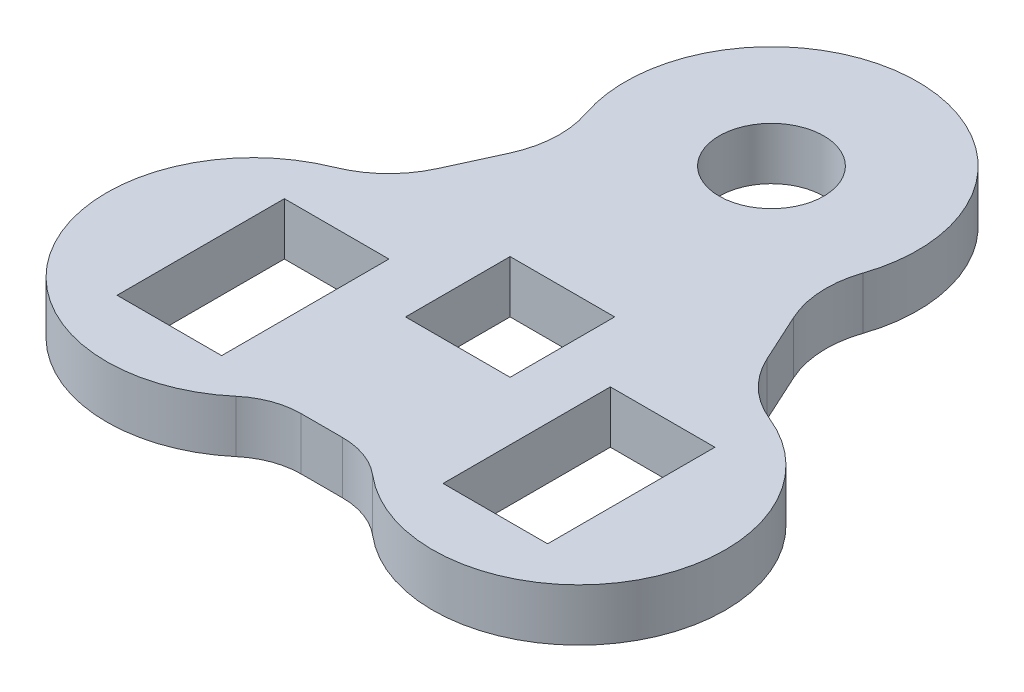
from build123d import *

# Parameters (mm, degrees)
SKETCH1_R           = 50
SKETCH1_W           = 100
SKETCH1_H           = 100
SKETCH1_H_2         = 160
BOSS_EXTRUDE1_DEPTH = 50


with BuildPart() as part:
    # Sketch1 → Boss-Extrude1 (new body)
    with BuildSketch(Plane(origin=(0, 0, 0), x_dir=(1, 0, 0), z_dir=(0, 1, 0))):
        with BuildLine():
            Line((-157.631299989, 88.07121729), (-136.663415109, 133.755017511))
            Line((-136.663415109, 133.755017511), (-135.958224263, 135.291452776))
            ThreePointArc((-135.958224263, 135.291452776), (-127.47369707, 169.829345008), (-132.36344953, 205.056373302))
            ThreePointArc((-132.36344953, 205.056373302), (0, 389.785594222), (132.36344953, 205.056373302))
            ThreePointArc((132.36344953, 205.056373302), (127.47369707, 169.829345008), (135.958224263, 135.291452776))
            Line((135.958224263, 135.291452776), (136.663415109, 133.755017511))
            Line((136.663415109, 133.755017511), (157.631299989, 88.07121729))
            ThreePointArc((157.631299989, 88.07121729), (178.287067415, 59.119663384), (208.18524924, 39.859551103))
            ThreePointArc((208.18524924, 39.859551103), (275.706725604, -162.3983111), (65.252859665, -196.699373836))
            ThreePointArc((65.252859665, -196.699373836), (44.010636723, -184.306940013), (19.797939242, -180))
            Line((19.797939242, -180), (-19.797939242, -180))
            ThreePointArc((-19.797939242, -180), (-44.010636723, -184.306940013), (-65.252859665, -196.699373836))
            ThreePointArc((-65.252859665, -196.699373836), (-275.706725604, -162.3983111), (-208.18524924, 39.859551103))
            ThreePointArc((-208.18524924, 39.859551103), (-178.287067415, 59.119663384), (-157.631299989, 88.07121729))
        make_face()
        with Locations(Location((0, 250, 0), (0, 0, 270))):
            Circle(SKETCH1_R, mode=Mode.SUBTRACT)
        Rectangle(SKETCH1_W, SKETCH1_H, mode=Mode.SUBTRACT)
        with Locations((155.884572681, -90)):
            Rectangle(SKETCH1_W, SKETCH1_H_2, mode=Mode.SUBTRACT)
        with Locations((-155.884572681, -90)):
            Rectangle(SKETCH1_W, SKETCH1_H_2, mode=Mode.SUBTRACT)
    extrude(amount=BOSS_EXTRUDE1_DEPTH)


solid = part.part
